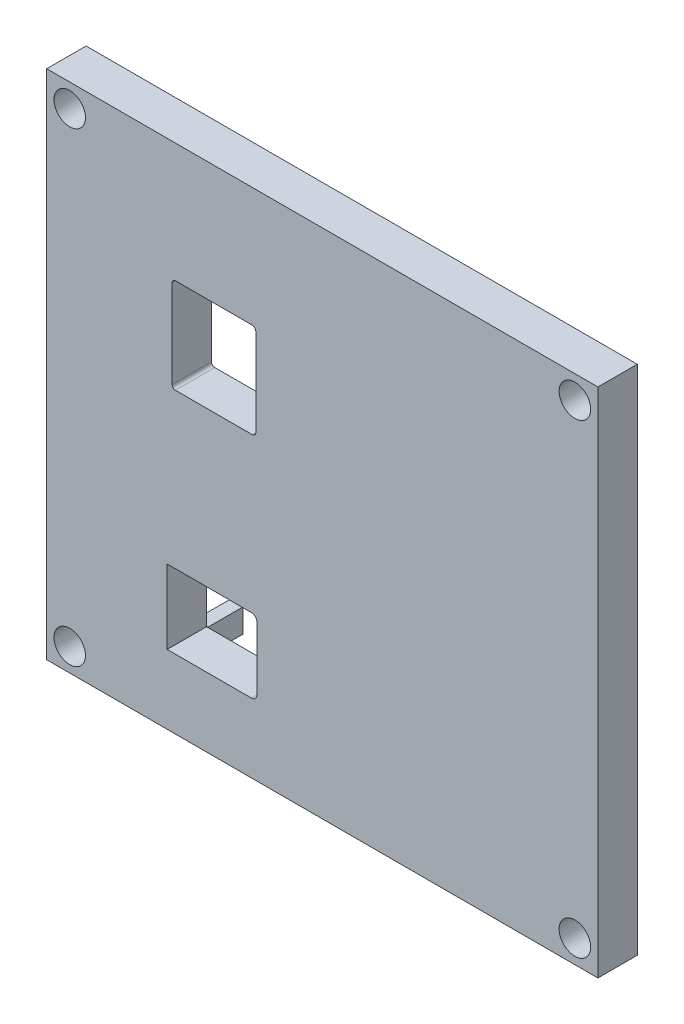
from build123d import *

# Parameters (mm, degrees)
SKIZZE1_R                       = 2
AUFSATZ_LINEAR_AUSTRAGEN1_DEPTH = 5
SKIZZE2_W                       = 1.65
SKIZZE2_H                       = 4.42
AUFSATZ_LINEAR_AUSTRAGEN2_DEPTH = 3
SKIZZE3_W                       = 2.08
SKIZZE3_H                       = 4.42
AUFSATZ_LINEAR_AUSTRAGEN3_DEPTH = 3


with BuildPart() as part:
    # Skizze1 → Aufsatz-Linear austragen1 (new body)
    # profile 1 of 2: a face of its own
    with BuildSketch(Plane.XY):
        Polygon((70, 5.85), (70, 59.15), (13.85, 59.15), (13.85, 58.15), (10.85, 58.15), (10.85, 59.15), (5.85, 59.15), (5.85, 5.85), (10.85, 5.85), (10.85, 6.85), (13.85, 6.85), (13.85, 5.85), align=None)
        with BuildLine():
            Line((26.7, 17.485), (26.7, 9.485))
            ThreePointArc((26.7, 9.485), (26.494974747, 8.990025253), (26, 8.785))
            Line((26, 8.785), (15.3, 8.785))
            Line((15.3, 8.785), (15.3, 18.185))
            Line((15.3, 18.185), (26, 18.185))
            ThreePointArc((26, 18.185), (26.494974747, 17.979974747), (26.7, 17.485))
        make_face(mode=Mode.SUBTRACT)
        with BuildLine():
            Line((16.34, 49.85), (25.99, 49.85))
            Line((25.99, 49.85), (26.09, 49.85))
            ThreePointArc((26.09, 49.85), (26.415269119, 49.715269119), (26.55, 49.39))
            Line((26.55, 49.39), (26.55, 38.27))
            ThreePointArc((26.55, 38.27), (26.415269119, 37.944730881), (26.09, 37.81))
            Line((26.09, 37.81), (25.99, 37.81))
            Line((25.99, 37.81), (16.34, 37.81))
            ThreePointArc((16.34, 37.81), (16.05008622, 37.93008622), (15.93, 38.22))
            Line((15.93, 38.22), (15.93, 49.44))
            ThreePointArc((15.93, 49.44), (16.05008622, 49.72991378), (16.34, 49.85))
        make_face(mode=Mode.SUBTRACT)
    # profile 2 of 2: a face of its own
    with BuildSketch(Plane.XY):
        Polygon((13.85, 59.15), (70, 59.15), (70, 65), (0, 65), (0, 0), (70, 0), (70, 5.85), (13.85, 5.85), (13.85, 6.85), (10.85, 6.85), (10.85, 5.85), (5.85, 5.85), (5.85, 59.15), (10.85, 59.15), (10.85, 58.15), (13.85, 58.15), align=None)
        with Locations((2.925, 2.925)):
            Circle(SKIZZE1_R, mode=Mode.SUBTRACT)
        with Locations((67.075, 2.925)):
            Circle(SKIZZE1_R, mode=Mode.SUBTRACT)
        with Locations((2.925, 62.075)):
            Circle(SKIZZE1_R, mode=Mode.SUBTRACT)
        with Locations((67.075, 62.075)):
            Circle(SKIZZE1_R, mode=Mode.SUBTRACT)
    extrude(amount=AUFSATZ_LINEAR_AUSTRAGEN1_DEPTH)

    # Skizze2 → Aufsatz-Linear austragen2 (add)
    with BuildSketch(Plane(origin=(0, 5.85, 0), x_dir=(1, 0, 0), z_dir=(0, 1, 0))):
        with Locations((14.675, 2.21)):
            Rectangle(SKIZZE2_W, SKIZZE2_H)
    extrude(amount=AUFSATZ_LINEAR_AUSTRAGEN2_DEPTH)

    # Skizze3 → Aufsatz-Linear austragen3 (add)
    with BuildSketch(Plane.XZ.offset(-59.15)):
        with Locations((14.89, -2.21)):
            Rectangle(SKIZZE3_W, SKIZZE3_H)
    extrude(amount=AUFSATZ_LINEAR_AUSTRAGEN3_DEPTH)


solid = part.part
